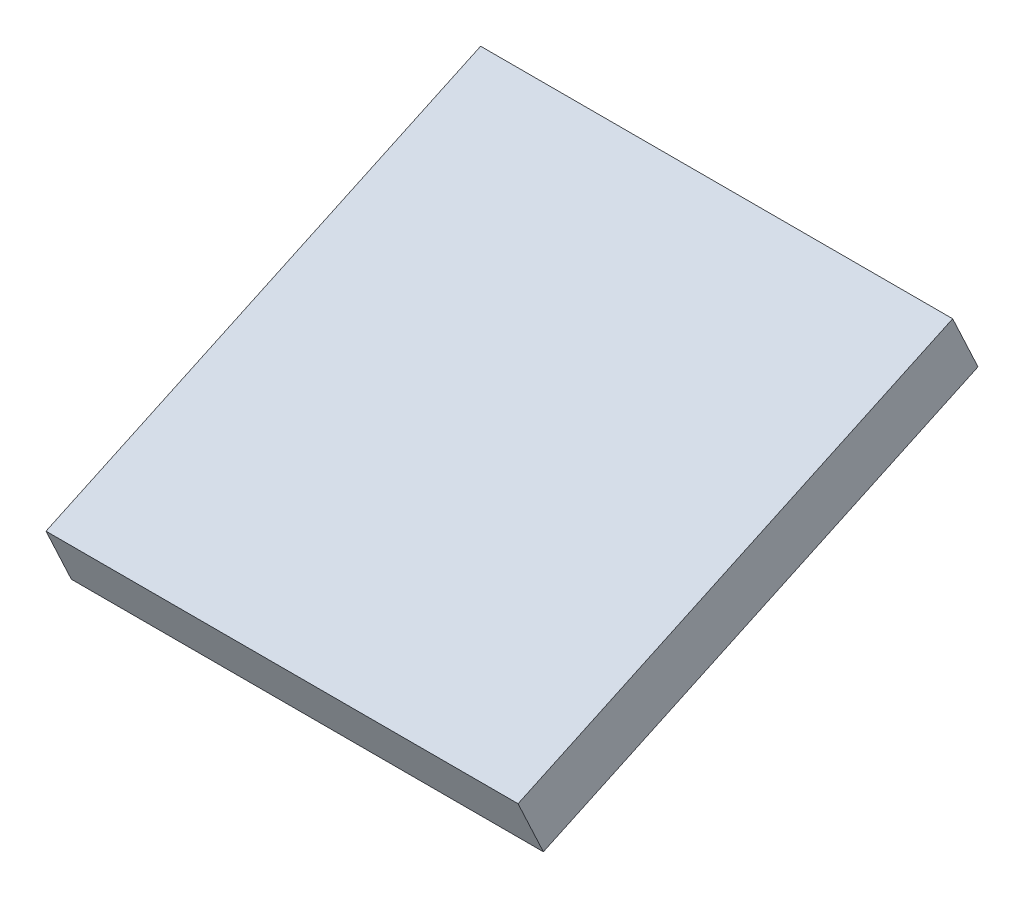
from build123d import *

# Parameters (mm, degrees)
BOSS_EXTRUDE1_DEPTH = 100.0125


with BuildPart() as part:
    # Sketch3 → Boss-Extrude1 (new body)
    with BuildSketch(Plane(origin=(0, 0, 0), x_dir=(0, 0, -1), z_dir=(1, 0, 0))):
        Polygon((-92.080871163, 0), (0, 42.938015393), (-5.367251924, 54.448124288), (-97.448123087, 11.510108895), align=None)
    extrude(amount=-BOSS_EXTRUDE1_DEPTH)


solid = part.part
